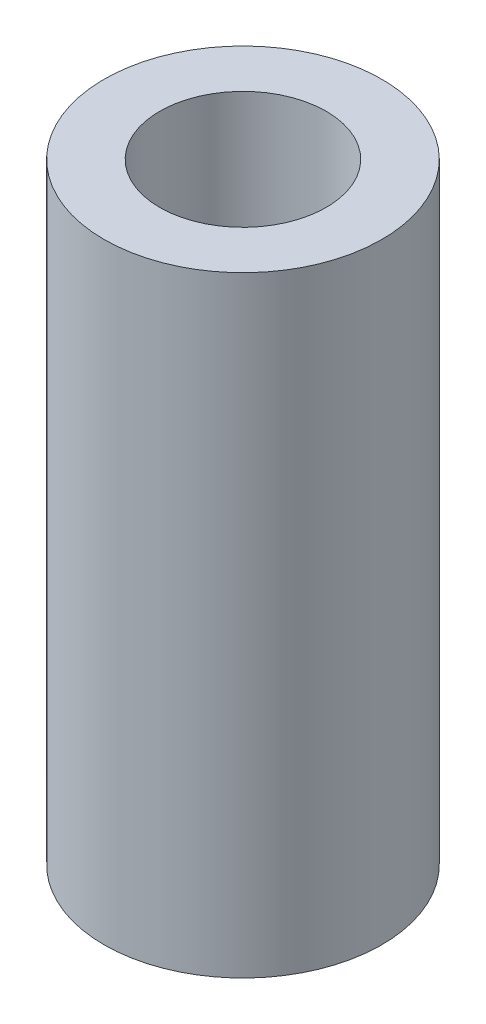
from build123d import *

# Parameters (mm, degrees)
SKETCH1_R           = 2.5
SKETCH1_R_2         = 1.5
BOSS_EXTRUDE1_DEPTH = 11


with BuildPart() as part:
    # Sketch1 → Boss-Extrude1 (new body)
    with BuildSketch(Plane(origin=(0, 0, 0), x_dir=(1, 0, 0), z_dir=(0, 1, 0))):
        with Locations(Location((0, 0, 0), (0, 0, 270))):
            Circle(SKETCH1_R)
        with Locations(Location((0, 0, 0), (0, 0, 270))):
            Circle(SKETCH1_R_2, mode=Mode.SUBTRACT)
    extrude(amount=BOSS_EXTRUDE1_DEPTH)


solid = part.part
